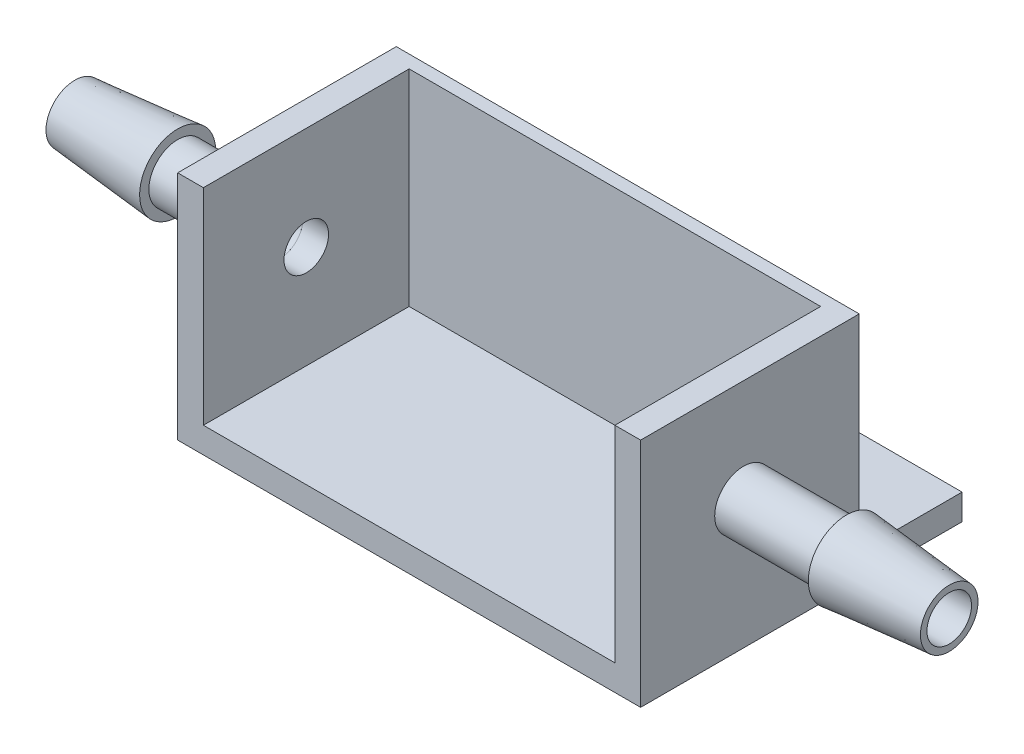
from build123d import *

# Parameters (mm, degrees)
BOSS_EXTRUDE1_DEPTH     = 25.4
SKETCH2_W               = 114.3
SKETCH2_H               = 57.15
BOSS_EXTRUDE2_DEPTH     = 3.175
CUT_EXTRUDE2_DEPTH      = 126.442638784
CUT_EXTRUDE2_DEPTH_BACK = 126.442638784
SKETCH3_R               = 5.5
SKETCH5_W               = 114.3
SKETCH5_H               = 25.4
SKETCH5_R               = 3.429
BOSS_EXTRUDE3_DEPTH     = 6.35


with BuildPart() as part:
    # Sketch1 → Boss-Extrude1 (new, symmetric)
    with BuildSketch(Plane.XY):
        Polygon((-57.15, 0), (57.15, 0), (57.15, 6.35), (57.15, 57.15), (50.8, 57.15), (50.8, 6.35), (-50.8, 6.35), (-50.8, 57.15), (-57.15, 57.15), (-57.15, 6.35), align=None)
    extrude(amount=BOSS_EXTRUDE1_DEPTH, both=True)

    # Sketch2 → Boss-Extrude2 (add)
    with BuildSketch(Plane(origin=(0, 0, -25.4), x_dir=(-1, 0, 0), z_dir=(0, 0, -1))):
        with Locations((0, 28.575)):
            Rectangle(SKETCH2_W, SKETCH2_H)
    extrude(amount=BOSS_EXTRUDE2_DEPTH)


with BuildPart() as body_2:
    # Sketch4 → Revolve1 (revolve)
    with BuildSketch(Plane.XY, mode=Mode.PRIVATE) as revolve1_sk:
        Polygon((57.15, 35.687), (57.15, 38.862), (82.55, 38.862), (82.55, 41.148), (107.95, 38.862), (107.95, 35.687), align=None)
        Polygon((-57.15, 38.862), (-82.55, 38.862), (-82.55, 41.148), (-107.95, 38.862), (-107.95, 35.687), (-107.95, 31.75), (-57.15, 31.75), (-57.15, 35.687), align=None)
    revolve(revolve1_sk.sketch.rotate(Axis((-76.2, 31.75, 0), (1, 0, 0)), 90), axis=Axis((-76.2, 31.75, 0), (1, 0, 0)))


with BuildPart() as cut_extrude2_tool:
    # Sketch3 → Cut-Extrude2 (new, two sides: drawn at the far end of the back side and taken through both)
    with BuildSketch(Plane(origin=(0, 0, 0), x_dir=(0, 0, -1), z_dir=(1, 0, 0)).offset(-CUT_EXTRUDE2_DEPTH_BACK)):
        with Locations((0, 31.75)):
            Circle(SKETCH3_R)
    extrude(amount=CUT_EXTRUDE2_DEPTH + CUT_EXTRUDE2_DEPTH_BACK)


with BuildPart() as part_1:
    add(part.part)

    # Cut-Extrude2: cut by cut_extrude2_tool
    add(cut_extrude2_tool.part, mode=Mode.SUBTRACT)

    # Sketch5 → Boss-Extrude3 (add)
    with BuildSketch(Plane(origin=(0, 0, 0), x_dir=(-1, 0, 0), z_dir=(0, -1, 0))):
        with Locations((0, 41.275)):
            Rectangle(SKETCH5_W, SKETCH5_H)
        with Locations(Location((-38.1, 41.275, 0), (0, 0, 90))):
            Circle(SKETCH5_R, mode=Mode.SUBTRACT)
        with Locations(Location((-12.7, 41.275, 0), (0, 0, 90))):
            Circle(SKETCH5_R, mode=Mode.SUBTRACT)
        with Locations(Location((12.7, 41.275, 0), (0, 0, 90))):
            Circle(SKETCH5_R, mode=Mode.SUBTRACT)
        with Locations(Location((38.1, 41.275, 0), (0, 0, 90))):
            Circle(SKETCH5_R, mode=Mode.SUBTRACT)
    extrude(amount=-BOSS_EXTRUDE3_DEPTH)


with BuildPart() as body_2_1:
    add(body_2.part)

    # Cut-Extrude2: cut by cut_extrude2_tool
    add(cut_extrude2_tool.part, mode=Mode.SUBTRACT)


solid = Compound([part_1.part, body_2_1.part])
